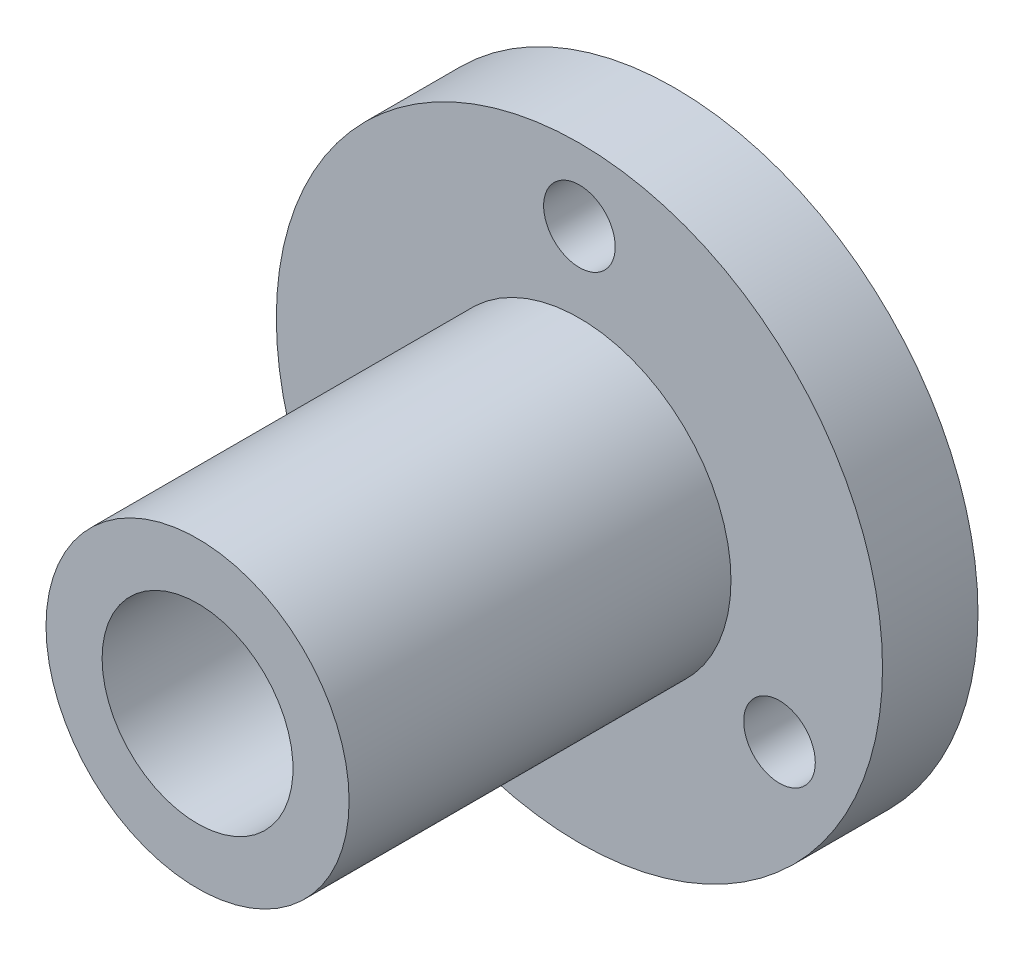
from build123d import *

# Parameters (mm, degrees)
SKETCH1_R           = 12.7
BOSS_EXTRUDE1_DEPTH = 4
SKETCH2_R           = 6.35
BOSS_EXTRUDE2_DEPTH = 16
SKETCH3_R           = 4
CUT_EXTRUDE1_DEPTH  = 27.880848201
SKETCH4_R           = 1.5
CUT_EXTRUDE2_DEPTH  = 25.053689946
CHAMFER1_SIZE       = 1.5


with BuildPart() as part:
    # Sketch1 → Boss-Extrude1 (new body)
    with BuildSketch(Plane.XY):
        Circle(SKETCH1_R)
    extrude(amount=BOSS_EXTRUDE1_DEPTH)

    # Sketch2 → Boss-Extrude2 (add)
    with BuildSketch(Plane.XY.offset(4)):
        Circle(SKETCH2_R)
    extrude(amount=BOSS_EXTRUDE2_DEPTH)

    # Sketch3 → Cut-Extrude1 (cut, through all)
    with BuildSketch(Plane(origin=(0, 0, 0), x_dir=(-1, 0, 0), z_dir=(0, 0, -1))):
        Circle(SKETCH3_R)
    extrude(amount=-CUT_EXTRUDE1_DEPTH, mode=Mode.SUBTRACT)

    # Sketch4 → Cut-Extrude2 (cut, through all)
    with BuildSketch(Plane.XY.offset(4)):
        with Locations((0, 9.679602242)):
            Circle(SKETCH4_R)
        with Locations((8.38278144, -4.839801121)):
            Circle(SKETCH4_R)
        with Locations((-8.38278144, -4.839801121)):
            Circle(SKETCH4_R)
    extrude(amount=-CUT_EXTRUDE2_DEPTH, mode=Mode.SUBTRACT)

    # Chamfer1
    chamfer1_edges = [part.edges().sort_by_distance(p)[0] for p in [
        (-1.5, 9.679602242, 0),
        (6.88278144, -4.839801121, 0),
        (-9.88278144, -4.839801121, 0),
    ]]
    chamfer(chamfer1_edges, length=CHAMFER1_SIZE)


solid = part.part
